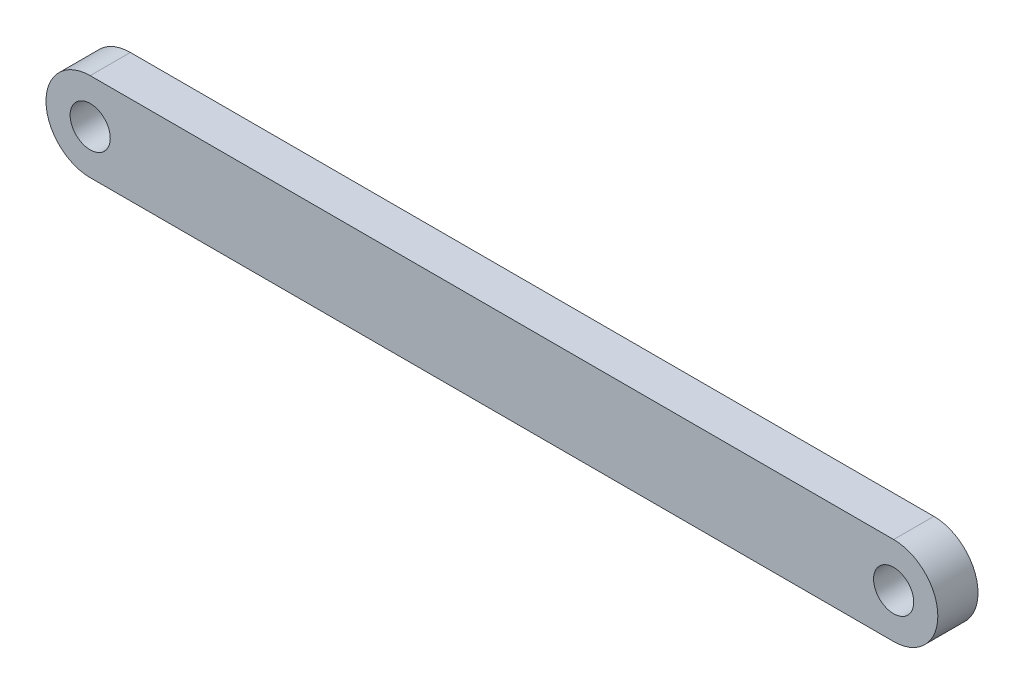
from build123d import *

# Parameters (mm, degrees)
BOSS_EXTRUDE1_DEPTH     = 6.35
CUT_EXTRUDE1_DEPTH      = 72.114330131
CUT_EXTRUDE1_DEPTH_BACK = 72.114330131
SKETCH2_R               = 3.175
SCALE1_SCALE            = 4


with BuildPart() as part:
    # Sketch1 → Boss-Extrude1 (new body)
    with BuildSketch(Plane.XY):
        with BuildLine():
            Line((-63.5, 6.985), (63.5, 6.985))
            ThreePointArc((63.5, 6.985), (70.485, 0), (63.5, -6.985))
            Line((63.5, -6.985), (-63.5, -6.985))
            ThreePointArc((-63.5, -6.985), (-70.485, 0), (-63.5, 6.985))
        make_face()
    extrude(amount=BOSS_EXTRUDE1_DEPTH)

    # Sketch2 → Cut-Extrude1 (cut, two sides: drawn at the far end of the back side and taken through both)
    with BuildSketch(Plane.XY.offset(6.35).offset(-CUT_EXTRUDE1_DEPTH_BACK)):
        with Locations((63.5, 0)):
            Circle(SKETCH2_R)
        with Locations((-63.5, 0)):
            Circle(SKETCH2_R)
    extrude(amount=CUT_EXTRUDE1_DEPTH + CUT_EXTRUDE1_DEPTH_BACK, mode=Mode.SUBTRACT)


with BuildPart() as part_1:
    # Scale1: scaled about (0, 0, 3.175)
    add(part.part.scale(SCALE1_SCALE).moved(Location((0, 0, -9.525))))


solid = part_1.part
